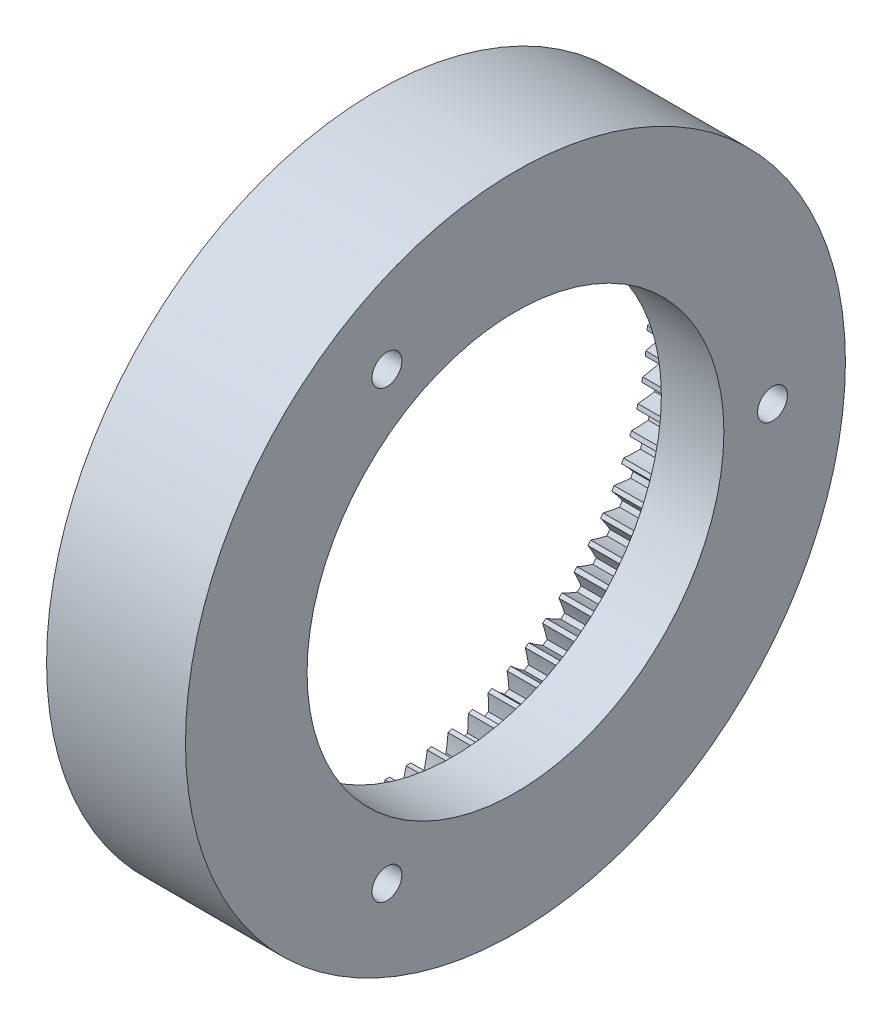
from build123d import *

# Parameters (mm, degrees)
BASPROSKE_W         = 10
BASPROSKE_H         = 8.5
TOOTHCUT_DEPTH      = 68.915388536
TEETHCUTS_COUNT     = 80
TEETHCUTS_ANGLE     = 355.5
SKETCH1_R           = 47.5
BOSS_EXTRUDE1_DEPTH = 1
BOSS_EXTRUDE3_START = 9
SKETCH3_R           = 47.5
BOSS_EXTRUDE3_DEPTH = 9
SKETCH4_R           = 2.15
CUT_EXTRUDE1_DEPTH  = 7
SKETCH4_3_R         = 30
CUT_EXTRUDE2_DEPTH  = 71.089228844


with BuildPart() as part:
    # BasProSke → Base-Revolve (revolve)
    with BuildSketch(Plane(origin=(0, 0, 0), x_dir=(1, 0, 0), z_dir=(0, 1, 0))):
        with Locations((5, 43.25)):
            Rectangle(BASPROSKE_W, BASPROSKE_H)
    revolve(axis=Axis((-10, 0, 0), (1, 0, 0)))

    # TooCutSke → ToothCut (cut, through all)
    with BuildSketch(Plane(origin=(0, 0, 0), x_dir=(0, 0, -1), z_dir=(1, 0, 0))):
        with BuildLine():
            ThreePointArc((1.225305221, 38.955334324), (0.834368139, 40.115367933), (0.373194628, 41.249311834))
            ThreePointArc((0.373194628, 41.249311834), (0, 41.251), (-0.373194628, 41.249311834))
            ThreePointArc((-0.373194628, 41.249311834), (-0.834368139, 40.115367933), (-1.225305221, 38.955334324))
            ThreePointArc((-1.225305221, 38.955334324), (0, 38.9746), (1.225305221, 38.955334324))
        make_face()
    toothcut = extrude(amount=TOOTHCUT_DEPTH, mode=Mode.SUBTRACT)

    # TeethCuts: ToothCut ×80 about axis
    teethcuts_axis = Axis((-10, 0, 0), (1, 0, 0))
    for i in range(1, TEETHCUTS_COUNT):
        add(toothcut.rotate(teethcuts_axis, i * TEETHCUTS_ANGLE / (TEETHCUTS_COUNT - 1)), mode=Mode.SUBTRACT)

    # Sketch1 → Boss-Extrude1 (add)
    with BuildSketch(Plane(origin=(10, 0, 0), x_dir=(0, 0, -1), z_dir=(1, 0, 0))):
        Circle(SKETCH1_R)
        with BuildLine():
            ThreePointArc((2.864339513, 41.151434485), (2.321264091, 40.069331457), (1.844660728, 38.956350276))
            ThreePointArc((1.844660728, 38.956350276), (1.531132815, 38.969932413), (1.217505761, 38.980991261))
            ThreePointArc((1.217505761, 38.980991261), (0.829695104, 40.127935362), (0.373194628, 41.249311834))
            ThreePointArc((0.373194628, 41.249311834), (0, 41.251), (-0.373194628, 41.249311834))
            ThreePointArc((-0.373194628, 41.249311834), (-0.829695104, 40.127935362), (-1.217505761, 38.980991261))
            ThreePointArc((-1.217505761, 38.980991261), (-1.531132815, 38.969932413), (-1.844660728, 38.956350276))
            ThreePointArc((-1.844660728, 38.956350276), (-2.321264091, 40.069331457), (-2.864339513, 41.151434485))
            ThreePointArc((-2.864339513, 41.151434485), (-3.236516158, 41.123836934), (-3.608427899, 41.092873459))
            ThreePointArc((-3.608427899, 41.092873459), (-3.975538953, 39.939137202), (-4.272165922, 38.765301474))
            ThreePointArc((-4.272165922, 38.765301474), (-4.583958501, 38.729669821), (-4.89545427, 38.691530436))
            ThreePointArc((-4.89545427, 38.691530436), (-5.457911921, 39.763686799), (-6.084214047, 40.799844858))
            ThreePointArc((-6.084214047, 40.799844858), (-6.453078117, 40.743131738), (-6.821414013, 40.683083854))
            ThreePointArc((-6.821414013, 40.683083854), (-7.096872282, 39.50410098), (-7.300486759, 38.310610711))
            ThreePointArc((-7.300486759, 38.310610711), (-7.608522559, 38.250625936), (-7.916065709, 38.188164445))
            ThreePointArc((-7.916065709, 38.188164445), (-8.560909909, 39.212885789), (-9.266577379, 40.19671062))
            ThreePointArc((-9.266577379, 40.19671062), (-9.629854704, 40.111231586), (-9.99234384, 40.022469509))
            ThreePointArc((-9.99234384, 40.022469509), (-10.174451033, 38.825508838), (-10.283797668, 37.619722295))
            ThreePointArc((-10.283797668, 37.619722295), (-10.586177545, 37.535754222), (-10.88787197, 37.449355722))
            ThreePointArc((-10.88787197, 37.449355722), (-11.611127041, 38.420324299), (-12.39180918, 39.345750294))
            ThreePointArc((-12.39180918, 39.345750294), (-12.747260035, 39.232032354), (-13.101667545, 39.11510333))
            ThreePointArc((-13.101667545, 39.11510333), (-13.189300911, 37.907544524), (-13.203705545, 36.69689578))
            ThreePointArc((-13.203705545, 36.69689578), (-13.498565226, 36.589462101), (-13.79255088, 36.479659267))
            ThreePointArc((-13.79255088, 36.479659267), (-14.589757713, 37.390888733), (-15.440641357, 38.252210335))
            ThreePointArc((-15.440641357, 38.252210335), (-15.786074268, 38.110954596), (-16.130215113, 37.966579532))
            ThreePointArc((-16.130215113, 37.966579532), (-16.122834363, 36.755867593), (-16.042208186, 35.5478207))
            ThreePointArc((-16.042208186, 35.5478207), (-16.327729764, 35.417583779), (-16.612194127, 35.285053582))
            ThreePointArc((-16.612194127, 35.285053582), (-17.478437678, 36.130925905), (-18.394276845, 36.922832778))
            ThreePointArc((-18.394276845, 36.922832778), (-18.727562105, 36.754910129), (-19.059314541, 36.583979147))
            ThreePointArc((-19.059314541, 36.583979147), (-18.956965179, 35.377578515), (-18.781805279, 34.179581484))
            ThreePointArc((-18.781805279, 34.179581484), (-19.056228418, 34.027344276), (-19.329417673, 33.872903808))
            ThreePointArc((-19.329417673, 33.872903808), (-20.259357262, 34.648203903), (-21.2345055, 35.365813679))
            ThreePointArc((-21.2345055, 35.365813679), (-21.553588293, 35.17225942), (-21.870906957, 34.975826364))
            ThreePointArc((-21.870906957, 34.975826364), (-21.674220001, 33.781174901), (-21.405606297, 32.600613783))
            ThreePointArc((-21.405606297, 32.600613783), (-21.667239088, 32.42731488), (-21.927468932, 32.251916319))
            ThreePointArc((-21.927468932, 32.251916319), (-22.915371172, 32.951864203), (-23.943816367, 33.590752578))
            ThreePointArc((-23.943816367, 33.590752578), (-24.246729442, 33.372760035), (-24.547657959, 33.152035981))
            ThreePointArc((-24.547657959, 33.152035981), (-24.25784605, 31.976499111), (-23.897434635, 30.820652457))
            ThreePointArc((-23.897434635, 30.820652457), (-24.144664023, 30.627360304), (-24.390330053, 30.43208504))
            ThreePointArc((-24.390330053, 30.43208504), (-25.430104198, 31.052365302), (-26.505505644, 31.608593318))
            ThreePointArc((-26.505505644, 31.608593318), (-26.790381442, 31.367506487), (-27.073064487, 31.123852273))
            ThreePointArc((-27.073064487, 31.123852273), (-26.691914411, 29.974677571), (-26.241927341, 28.85067156))
            ThreePointArc((-26.241927341, 28.85067156), (-26.473229076, 28.638577868), (-26.702816679, 28.424629838))
            ThreePointArc((-26.702816679, 28.424629838), (-27.788052175, 28.961418244), (-28.903779665, 29.431556569))
            ThreePointArc((-28.903779665, 29.431556569), (-29.168861831, 29.168861831), (-29.431556569, 28.903779665))
            ThreePointArc((-29.431556569, 28.903779665), (-28.961418244, 27.788052175), (-28.424629838, 26.702816679))
            ThreePointArc((-28.424629838, 26.702816679), (-28.638577868, 26.473229076), (-28.85067156, 26.241927341))
            ThreePointArc((-28.85067156, 26.241927341), (-29.974677571, 26.691914411), (-31.123852273, 27.073064487))
            ThreePointArc((-31.123852273, 27.073064487), (-31.367506487, 26.790381442), (-31.608593318, 26.505505644))
            ThreePointArc((-31.608593318, 26.505505644), (-31.052365302, 25.430104198), (-30.43208504, 24.390330053))
            ThreePointArc((-30.43208504, 24.390330053), (-30.627360304, 24.144664023), (-30.820652457, 23.897434635))
            ThreePointArc((-30.820652457, 23.897434635), (-31.976499111, 24.25784605), (-33.152035981, 24.547657959))
            ThreePointArc((-33.152035981, 24.547657959), (-33.372760035, 24.246729442), (-33.590752578, 23.943816367))
            ThreePointArc((-33.590752578, 23.943816367), (-32.951864203, 22.915371172), (-32.251916319, 21.927468932))
            ThreePointArc((-32.251916319, 21.927468932), (-32.42731488, 21.667239088), (-32.600613783, 21.405606297))
            ThreePointArc((-32.600613783, 21.405606297), (-33.781174901, 21.674220001), (-34.975826364, 21.870906957))
            ThreePointArc((-34.975826364, 21.870906957), (-35.17225942, 21.553588293), (-35.365813679, 21.2345055))
            ThreePointArc((-35.365813679, 21.2345055), (-34.648203903, 20.259357262), (-33.872903808, 19.329417673))
            ThreePointArc((-33.872903808, 19.329417673), (-34.027344276, 19.056228418), (-34.179581484, 18.781805279))
            ThreePointArc((-34.179581484, 18.781805279), (-35.377578515, 18.956965179), (-36.583979147, 19.059314541))
            ThreePointArc((-36.583979147, 19.059314541), (-36.754910129, 18.727562105), (-36.922832778, 18.394276845))
            ThreePointArc((-36.922832778, 18.394276845), (-36.130925905, 17.478437678), (-35.285053582, 16.612194127))
            ThreePointArc((-35.285053582, 16.612194127), (-35.417583779, 16.327729764), (-35.5478207, 16.042208186))
            ThreePointArc((-35.5478207, 16.042208186), (-36.755867593, 16.122834363), (-37.966579532, 16.130215113))
            ThreePointArc((-37.966579532, 16.130215113), (-38.110954596, 15.786074268), (-38.252210335, 15.440641357))
            ThreePointArc((-38.252210335, 15.440641357), (-37.390888733, 14.589757713), (-36.479659267, 13.79255088))
            ThreePointArc((-36.479659267, 13.79255088), (-36.589462101, 13.498565226), (-36.69689578, 13.203705545))
            ThreePointArc((-36.69689578, 13.203705545), (-37.907544524, 13.189300911), (-39.11510333, 13.101667545))
            ThreePointArc((-39.11510333, 13.101667545), (-39.232032354, 12.747260035), (-39.345750294, 12.39180918))
            ThreePointArc((-39.345750294, 12.39180918), (-38.420324299, 11.611127041), (-37.449355722, 10.88787197))
            ThreePointArc((-37.449355722, 10.88787197), (-37.535754222, 10.586177545), (-37.619722295, 10.283797668))
            ThreePointArc((-37.619722295, 10.283797668), (-38.825508838, 10.174451033), (-40.022469509, 9.99234384))
            ThreePointArc((-40.022469509, 9.99234384), (-40.111231586, 9.629854704), (-40.19671062, 9.266577379))
            ThreePointArc((-40.19671062, 9.266577379), (-39.212885789, 8.560909909), (-38.188164445, 7.916065709))
            ThreePointArc((-38.188164445, 7.916065709), (-38.250625936, 7.608522559), (-38.310610711, 7.300486759))
            ThreePointArc((-38.310610711, 7.300486759), (-39.50410098, 7.096872282), (-40.683083854, 6.821414013))
            ThreePointArc((-40.683083854, 6.821414013), (-40.743131738, 6.453078117), (-40.799844858, 6.084214047))
            ThreePointArc((-40.799844858, 6.084214047), (-39.763686799, 5.457911921), (-38.691530436, 4.89545427))
            ThreePointArc((-38.691530436, 4.89545427), (-38.729669821, 4.583958501), (-38.765301474, 4.272165922))
            ThreePointArc((-38.765301474, 4.272165922), (-39.939137202, 3.975538953), (-41.092873459, 3.608427899))
            ThreePointArc((-41.092873459, 3.608427899), (-41.123836934, 3.236516158), (-41.151434485, 2.864339513))
            ThreePointArc((-41.151434485, 2.864339513), (-40.069331457, 2.321264091), (-38.956350276, 1.844660728))
            ThreePointArc((-38.956350276, 1.844660728), (-38.969932413, 1.531132815), (-38.980991261, 1.217505761))
            ThreePointArc((-38.980991261, 1.217505761), (-40.127935362, 0.829695104), (-41.249311834, 0.373194628))
            ThreePointArc((-41.249311834, 0.373194628), (-41.251, 0), (-41.249311834, -0.373194628))
            ThreePointArc((-41.249311834, -0.373194628), (-40.127935362, -0.829695104), (-38.980991261, -1.217505761))
            ThreePointArc((-38.980991261, -1.217505761), (-38.969932413, -1.531132815), (-38.956350276, -1.844660728))
            ThreePointArc((-38.956350276, -1.844660728), (-40.069331457, -2.321264091), (-41.151434485, -2.864339513))
            ThreePointArc((-41.151434485, -2.864339513), (-41.123836934, -3.236516158), (-41.092873459, -3.608427899))
            ThreePointArc((-41.092873459, -3.608427899), (-39.939137202, -3.975538953), (-38.765301474, -4.272165922))
            ThreePointArc((-38.765301474, -4.272165922), (-38.729669821, -4.583958501), (-38.691530436, -4.89545427))
            ThreePointArc((-38.691530436, -4.89545427), (-39.763686799, -5.457911921), (-40.799844858, -6.084214047))
            ThreePointArc((-40.799844858, -6.084214047), (-40.743131738, -6.453078117), (-40.683083854, -6.821414013))
            ThreePointArc((-40.683083854, -6.821414013), (-39.50410098, -7.096872282), (-38.310610711, -7.300486759))
            ThreePointArc((-38.310610711, -7.300486759), (-38.250625936, -7.608522559), (-38.188164445, -7.916065709))
            ThreePointArc((-38.188164445, -7.916065709), (-39.212885789, -8.560909909), (-40.19671062, -9.266577379))
            ThreePointArc((-40.19671062, -9.266577379), (-40.111231586, -9.629854704), (-40.022469509, -9.99234384))
            ThreePointArc((-40.022469509, -9.99234384), (-38.825508838, -10.174451033), (-37.619722295, -10.283797668))
            ThreePointArc((-37.619722295, -10.283797668), (-37.535754222, -10.586177545), (-37.449355722, -10.88787197))
            ThreePointArc((-37.449355722, -10.88787197), (-38.420324299, -11.611127041), (-39.345750294, -12.39180918))
            ThreePointArc((-39.345750294, -12.39180918), (-39.232032354, -12.747260035), (-39.11510333, -13.101667545))
            ThreePointArc((-39.11510333, -13.101667545), (-37.907544524, -13.189300911), (-36.69689578, -13.203705545))
            ThreePointArc((-36.69689578, -13.203705545), (-36.589462101, -13.498565226), (-36.479659267, -13.79255088))
            ThreePointArc((-36.479659267, -13.79255088), (-37.390888733, -14.589757713), (-38.252210335, -15.440641357))
            ThreePointArc((-38.252210335, -15.440641357), (-38.110954596, -15.786074268), (-37.966579532, -16.130215113))
            ThreePointArc((-37.966579532, -16.130215113), (-36.755867593, -16.122834363), (-35.5478207, -16.042208186))
            ThreePointArc((-35.5478207, -16.042208186), (-35.417583779, -16.327729764), (-35.285053582, -16.612194127))
            ThreePointArc((-35.285053582, -16.612194127), (-36.130925905, -17.478437678), (-36.922832778, -18.394276845))
            ThreePointArc((-36.922832778, -18.394276845), (-36.754910129, -18.727562105), (-36.583979147, -19.059314541))
            ThreePointArc((-36.583979147, -19.059314541), (-35.377578515, -18.956965179), (-34.179581484, -18.781805279))
            ThreePointArc((-34.179581484, -18.781805279), (-34.027344276, -19.056228418), (-33.872903808, -19.329417673))
            ThreePointArc((-33.872903808, -19.329417673), (-34.648203903, -20.259357262), (-35.365813679, -21.2345055))
            ThreePointArc((-35.365813679, -21.2345055), (-35.17225942, -21.553588293), (-34.975826364, -21.870906957))
            ThreePointArc((-34.975826364, -21.870906957), (-33.781174901, -21.674220001), (-32.600613783, -21.405606297))
            ThreePointArc((-32.600613783, -21.405606297), (-32.42731488, -21.667239088), (-32.251916319, -21.927468932))
            ThreePointArc((-32.251916319, -21.927468932), (-32.951864203, -22.915371172), (-33.590752578, -23.943816367))
            ThreePointArc((-33.590752578, -23.943816367), (-33.372760035, -24.246729442), (-33.152035981, -24.547657959))
            ThreePointArc((-33.152035981, -24.547657959), (-31.976499111, -24.25784605), (-30.820652457, -23.897434635))
            ThreePointArc((-30.820652457, -23.897434635), (-30.627360304, -24.144664023), (-30.43208504, -24.390330053))
            ThreePointArc((-30.43208504, -24.390330053), (-31.052365302, -25.430104198), (-31.608593318, -26.505505644))
            ThreePointArc((-31.608593318, -26.505505644), (-31.367506487, -26.790381442), (-31.123852273, -27.073064487))
            ThreePointArc((-31.123852273, -27.073064487), (-29.974677571, -26.691914411), (-28.85067156, -26.241927341))
            ThreePointArc((-28.85067156, -26.241927341), (-28.638577868, -26.473229076), (-28.424629838, -26.702816679))
            ThreePointArc((-28.424629838, -26.702816679), (-28.961418244, -27.788052175), (-29.431556569, -28.903779665))
            ThreePointArc((-29.431556569, -28.903779665), (-29.168861831, -29.168861831), (-28.903779665, -29.431556569))
            ThreePointArc((-28.903779665, -29.431556569), (-27.788052175, -28.961418244), (-26.702816679, -28.424629838))
            ThreePointArc((-26.702816679, -28.424629838), (-26.473229076, -28.638577868), (-26.241927341, -28.85067156))
            ThreePointArc((-26.241927341, -28.85067156), (-26.691914411, -29.974677571), (-27.073064487, -31.123852273))
            ThreePointArc((-27.073064487, -31.123852273), (-26.790381442, -31.367506487), (-26.505505644, -31.608593318))
            ThreePointArc((-26.505505644, -31.608593318), (-25.430104198, -31.052365302), (-24.390330053, -30.43208504))
            ThreePointArc((-24.390330053, -30.43208504), (-24.144664023, -30.627360304), (-23.897434635, -30.820652457))
            ThreePointArc((-23.897434635, -30.820652457), (-24.25784605, -31.976499111), (-24.547657959, -33.152035981))
            ThreePointArc((-24.547657959, -33.152035981), (-24.246729442, -33.372760035), (-23.943816367, -33.590752578))
            ThreePointArc((-23.943816367, -33.590752578), (-22.915371172, -32.951864203), (-21.927468932, -32.251916319))
            ThreePointArc((-21.927468932, -32.251916319), (-21.667239088, -32.42731488), (-21.405606297, -32.600613783))
            ThreePointArc((-21.405606297, -32.600613783), (-21.674220001, -33.781174901), (-21.870906957, -34.975826364))
            ThreePointArc((-21.870906957, -34.975826364), (-21.553588293, -35.17225942), (-21.2345055, -35.365813679))
            ThreePointArc((-21.2345055, -35.365813679), (-20.259357262, -34.648203903), (-19.329417673, -33.872903808))
            ThreePointArc((-19.329417673, -33.872903808), (-19.056228418, -34.027344276), (-18.781805279, -34.179581484))
            ThreePointArc((-18.781805279, -34.179581484), (-18.956965179, -35.377578515), (-19.059314541, -36.583979147))
            ThreePointArc((-19.059314541, -36.583979147), (-18.727562105, -36.754910129), (-18.394276845, -36.922832778))
            ThreePointArc((-18.394276845, -36.922832778), (-17.478437678, -36.130925905), (-16.612194127, -35.285053582))
            ThreePointArc((-16.612194127, -35.285053582), (-16.327729764, -35.417583779), (-16.042208186, -35.5478207))
            ThreePointArc((-16.042208186, -35.5478207), (-16.122834363, -36.755867593), (-16.130215113, -37.966579532))
            ThreePointArc((-16.130215113, -37.966579532), (-15.786074268, -38.110954596), (-15.440641357, -38.252210335))
            ThreePointArc((-15.440641357, -38.252210335), (-14.589757713, -37.390888733), (-13.79255088, -36.479659267))
            ThreePointArc((-13.79255088, -36.479659267), (-13.498565226, -36.589462101), (-13.203705545, -36.69689578))
            ThreePointArc((-13.203705545, -36.69689578), (-13.189300911, -37.907544524), (-13.101667545, -39.11510333))
            ThreePointArc((-13.101667545, -39.11510333), (-12.747260035, -39.232032354), (-12.39180918, -39.345750294))
            ThreePointArc((-12.39180918, -39.345750294), (-11.611127041, -38.420324299), (-10.88787197, -37.449355722))
            ThreePointArc((-10.88787197, -37.449355722), (-10.586177545, -37.535754222), (-10.283797668, -37.619722295))
            ThreePointArc((-10.283797668, -37.619722295), (-10.174451033, -38.825508838), (-9.99234384, -40.022469509))
            ThreePointArc((-9.99234384, -40.022469509), (-9.629854704, -40.111231586), (-9.266577379, -40.19671062))
            ThreePointArc((-9.266577379, -40.19671062), (-8.560909909, -39.212885789), (-7.916065709, -38.188164445))
            ThreePointArc((-7.916065709, -38.188164445), (-7.608522559, -38.250625936), (-7.300486759, -38.310610711))
            ThreePointArc((-7.300486759, -38.310610711), (-7.096872282, -39.50410098), (-6.821414013, -40.683083854))
            ThreePointArc((-6.821414013, -40.683083854), (-6.453078117, -40.743131738), (-6.084214047, -40.799844858))
            ThreePointArc((-6.084214047, -40.799844858), (-5.457911921, -39.763686799), (-4.89545427, -38.691530436))
            ThreePointArc((-4.89545427, -38.691530436), (-4.583958501, -38.729669821), (-4.272165922, -38.765301474))
            ThreePointArc((-4.272165922, -38.765301474), (-3.975538953, -39.939137202), (-3.608427899, -41.092873459))
            ThreePointArc((-3.608427899, -41.092873459), (-3.236516158, -41.123836934), (-2.864339513, -41.151434485))
            ThreePointArc((-2.864339513, -41.151434485), (-2.321264091, -40.069331457), (-1.844660728, -38.956350276))
            ThreePointArc((-1.844660728, -38.956350276), (-1.531132815, -38.969932413), (-1.217505761, -38.980991261))
            ThreePointArc((-1.217505761, -38.980991261), (-0.829695104, -40.127935362), (-0.373194628, -41.249311834))
            ThreePointArc((-0.373194628, -41.249311834), (0, -41.251), (0.373194628, -41.249311834))
            ThreePointArc((0.373194628, -41.249311834), (0.829695104, -40.127935362), (1.217505761, -38.980991261))
            ThreePointArc((1.217505761, -38.980991261), (1.531132815, -38.969932413), (1.844660728, -38.956350276))
            ThreePointArc((1.844660728, -38.956350276), (2.321264091, -40.069331457), (2.864339513, -41.151434485))
            ThreePointArc((2.864339513, -41.151434485), (3.236516158, -41.123836934), (3.608427899, -41.092873459))
            ThreePointArc((3.608427899, -41.092873459), (3.975538953, -39.939137202), (4.272165922, -38.765301474))
            ThreePointArc((4.272165922, -38.765301474), (4.583958501, -38.729669821), (4.89545427, -38.691530436))
            ThreePointArc((4.89545427, -38.691530436), (5.457911921, -39.763686799), (6.084214047, -40.799844858))
            ThreePointArc((6.084214047, -40.799844858), (6.453078117, -40.743131738), (6.821414013, -40.683083854))
            ThreePointArc((6.821414013, -40.683083854), (7.096872282, -39.50410098), (7.300486759, -38.310610711))
            ThreePointArc((7.300486759, -38.310610711), (7.608522559, -38.250625936), (7.916065709, -38.188164445))
            ThreePointArc((7.916065709, -38.188164445), (8.560909909, -39.212885789), (9.266577379, -40.19671062))
            ThreePointArc((9.266577379, -40.19671062), (9.629854704, -40.111231586), (9.99234384, -40.022469509))
            ThreePointArc((9.99234384, -40.022469509), (10.174451033, -38.825508838), (10.283797668, -37.619722295))
            ThreePointArc((10.283797668, -37.619722295), (10.586177545, -37.535754222), (10.88787197, -37.449355722))
            ThreePointArc((10.88787197, -37.449355722), (11.611127041, -38.420324299), (12.39180918, -39.345750294))
            ThreePointArc((12.39180918, -39.345750294), (12.747260035, -39.232032354), (13.101667545, -39.11510333))
            ThreePointArc((13.101667545, -39.11510333), (13.189300911, -37.907544524), (13.203705545, -36.69689578))
            ThreePointArc((13.203705545, -36.69689578), (13.498565226, -36.589462101), (13.79255088, -36.479659267))
            ThreePointArc((13.79255088, -36.479659267), (14.589757713, -37.390888733), (15.440641357, -38.252210335))
            ThreePointArc((15.440641357, -38.252210335), (15.786074268, -38.110954596), (16.130215113, -37.966579532))
            ThreePointArc((16.130215113, -37.966579532), (16.122834363, -36.755867593), (16.042208186, -35.5478207))
            ThreePointArc((16.042208186, -35.5478207), (16.327729764, -35.417583779), (16.612194127, -35.285053582))
            ThreePointArc((16.612194127, -35.285053582), (17.478437678, -36.130925905), (18.394276845, -36.922832778))
            ThreePointArc((18.394276845, -36.922832778), (18.727562105, -36.754910129), (19.059314541, -36.583979147))
            ThreePointArc((19.059314541, -36.583979147), (18.956965179, -35.377578515), (18.781805279, -34.179581484))
            ThreePointArc((18.781805279, -34.179581484), (19.056228418, -34.027344276), (19.329417673, -33.872903808))
            ThreePointArc((19.329417673, -33.872903808), (20.259357262, -34.648203903), (21.2345055, -35.365813679))
            ThreePointArc((21.2345055, -35.365813679), (21.553588293, -35.17225942), (21.870906957, -34.975826364))
            ThreePointArc((21.870906957, -34.975826364), (21.674220001, -33.781174901), (21.405606297, -32.600613783))
            ThreePointArc((21.405606297, -32.600613783), (21.667239088, -32.42731488), (21.927468932, -32.251916319))
            ThreePointArc((21.927468932, -32.251916319), (22.915371172, -32.951864203), (23.943816367, -33.590752578))
            ThreePointArc((23.943816367, -33.590752578), (24.246729442, -33.372760035), (24.547657959, -33.152035981))
            ThreePointArc((24.547657959, -33.152035981), (24.25784605, -31.976499111), (23.897434635, -30.820652457))
            ThreePointArc((23.897434635, -30.820652457), (24.144664023, -30.627360304), (24.390330053, -30.43208504))
            ThreePointArc((24.390330053, -30.43208504), (25.430104198, -31.052365302), (26.505505644, -31.608593318))
            ThreePointArc((26.505505644, -31.608593318), (26.790381442, -31.367506487), (27.073064487, -31.123852273))
            ThreePointArc((27.073064487, -31.123852273), (26.691914411, -29.974677571), (26.241927341, -28.85067156))
            ThreePointArc((26.241927341, -28.85067156), (26.473229076, -28.638577868), (26.702816679, -28.424629838))
            ThreePointArc((26.702816679, -28.424629838), (27.788052175, -28.961418244), (28.903779665, -29.431556569))
            ThreePointArc((28.903779665, -29.431556569), (29.168861831, -29.168861831), (29.431556569, -28.903779665))
            ThreePointArc((29.431556569, -28.903779665), (28.961418244, -27.788052175), (28.424629838, -26.702816679))
            ThreePointArc((28.424629838, -26.702816679), (28.638577868, -26.473229076), (28.85067156, -26.241927341))
            ThreePointArc((28.85067156, -26.241927341), (29.974677571, -26.691914411), (31.123852273, -27.073064487))
            ThreePointArc((31.123852273, -27.073064487), (31.367506487, -26.790381442), (31.608593318, -26.505505644))
            ThreePointArc((31.608593318, -26.505505644), (31.052365302, -25.430104198), (30.43208504, -24.390330053))
            ThreePointArc((30.43208504, -24.390330053), (30.627360304, -24.144664023), (30.820652457, -23.897434635))
            ThreePointArc((30.820652457, -23.897434635), (31.976499111, -24.25784605), (33.152035981, -24.547657959))
            ThreePointArc((33.152035981, -24.547657959), (33.372760035, -24.246729442), (33.590752578, -23.943816367))
            ThreePointArc((33.590752578, -23.943816367), (32.951864203, -22.915371172), (32.251916319, -21.927468932))
            ThreePointArc((32.251916319, -21.927468932), (32.42731488, -21.667239088), (32.600613783, -21.405606297))
            ThreePointArc((32.600613783, -21.405606297), (33.781174901, -21.674220001), (34.975826364, -21.870906957))
            ThreePointArc((34.975826364, -21.870906957), (35.17225942, -21.553588293), (35.365813679, -21.2345055))
            ThreePointArc((35.365813679, -21.2345055), (34.648203903, -20.259357262), (33.872903808, -19.329417673))
            ThreePointArc((33.872903808, -19.329417673), (34.027344276, -19.056228418), (34.179581484, -18.781805279))
            ThreePointArc((34.179581484, -18.781805279), (35.377578515, -18.956965179), (36.583979147, -19.059314541))
            ThreePointArc((36.583979147, -19.059314541), (36.754910129, -18.727562105), (36.922832778, -18.394276845))
            ThreePointArc((36.922832778, -18.394276845), (36.130925905, -17.478437678), (35.285053582, -16.612194127))
            ThreePointArc((35.285053582, -16.612194127), (35.417583779, -16.327729764), (35.5478207, -16.042208186))
            ThreePointArc((35.5478207, -16.042208186), (36.755867593, -16.122834363), (37.966579532, -16.130215113))
            ThreePointArc((37.966579532, -16.130215113), (38.110954596, -15.786074268), (38.252210335, -15.440641357))
            ThreePointArc((38.252210335, -15.440641357), (37.390888733, -14.589757713), (36.479659267, -13.79255088))
            ThreePointArc((36.479659267, -13.79255088), (36.589462101, -13.498565226), (36.69689578, -13.203705545))
            ThreePointArc((36.69689578, -13.203705545), (37.907544524, -13.189300911), (39.11510333, -13.101667545))
            ThreePointArc((39.11510333, -13.101667545), (39.232032354, -12.747260035), (39.345750294, -12.39180918))
            ThreePointArc((39.345750294, -12.39180918), (38.420324299, -11.611127041), (37.449355722, -10.88787197))
            ThreePointArc((37.449355722, -10.88787197), (37.535754222, -10.586177545), (37.619722295, -10.283797668))
            ThreePointArc((37.619722295, -10.283797668), (38.825508838, -10.174451033), (40.022469509, -9.99234384))
            ThreePointArc((40.022469509, -9.99234384), (40.111231586, -9.629854704), (40.19671062, -9.266577379))
            ThreePointArc((40.19671062, -9.266577379), (39.212885789, -8.560909909), (38.188164445, -7.916065709))
            ThreePointArc((38.188164445, -7.916065709), (38.250625936, -7.608522559), (38.310610711, -7.300486759))
            ThreePointArc((38.310610711, -7.300486759), (39.50410098, -7.096872282), (40.683083854, -6.821414013))
            ThreePointArc((40.683083854, -6.821414013), (40.743131738, -6.453078117), (40.799844858, -6.084214047))
            ThreePointArc((40.799844858, -6.084214047), (39.763686799, -5.457911921), (38.691530436, -4.89545427))
            ThreePointArc((38.691530436, -4.89545427), (38.729669821, -4.583958501), (38.765301474, -4.272165922))
            ThreePointArc((38.765301474, -4.272165922), (39.939137202, -3.975538953), (41.092873459, -3.608427899))
            ThreePointArc((41.092873459, -3.608427899), (41.123836934, -3.236516158), (41.151434485, -2.864339513))
            ThreePointArc((41.151434485, -2.864339513), (40.069331457, -2.321264091), (38.956350276, -1.844660728))
            ThreePointArc((38.956350276, -1.844660728), (38.969932413, -1.531132815), (38.980991261, -1.217505761))
            ThreePointArc((38.980991261, -1.217505761), (40.127935362, -0.829695104), (41.249311834, -0.373194628))
            ThreePointArc((41.249311834, -0.373194628), (41.251, 0), (41.249311834, 0.373194628))
            ThreePointArc((41.249311834, 0.373194628), (40.127935362, 0.829695104), (38.980991261, 1.217505761))
            ThreePointArc((38.980991261, 1.217505761), (38.969932413, 1.531132815), (38.956350276, 1.844660728))
            ThreePointArc((38.956350276, 1.844660728), (40.069331457, 2.321264091), (41.151434485, 2.864339513))
            ThreePointArc((41.151434485, 2.864339513), (41.123836934, 3.236516158), (41.092873459, 3.608427899))
            ThreePointArc((41.092873459, 3.608427899), (39.939137202, 3.975538953), (38.765301474, 4.272165922))
            ThreePointArc((38.765301474, 4.272165922), (38.729669821, 4.583958501), (38.691530436, 4.89545427))
            ThreePointArc((38.691530436, 4.89545427), (39.763686799, 5.457911921), (40.799844858, 6.084214047))
            ThreePointArc((40.799844858, 6.084214047), (40.743131738, 6.453078117), (40.683083854, 6.821414013))
            ThreePointArc((40.683083854, 6.821414013), (39.50410098, 7.096872282), (38.310610711, 7.300486759))
            ThreePointArc((38.310610711, 7.300486759), (38.250625936, 7.608522559), (38.188164445, 7.916065709))
            ThreePointArc((38.188164445, 7.916065709), (39.212885789, 8.560909909), (40.19671062, 9.266577379))
            ThreePointArc((40.19671062, 9.266577379), (40.111231586, 9.629854704), (40.022469509, 9.99234384))
            ThreePointArc((40.022469509, 9.99234384), (38.825508838, 10.174451033), (37.619722295, 10.283797668))
            ThreePointArc((37.619722295, 10.283797668), (37.535754222, 10.586177545), (37.449355722, 10.88787197))
            ThreePointArc((37.449355722, 10.88787197), (38.420324299, 11.611127041), (39.345750294, 12.39180918))
            ThreePointArc((39.345750294, 12.39180918), (39.232032354, 12.747260035), (39.11510333, 13.101667545))
            ThreePointArc((39.11510333, 13.101667545), (37.907544524, 13.189300911), (36.69689578, 13.203705545))
            ThreePointArc((36.69689578, 13.203705545), (36.589462101, 13.498565226), (36.479659267, 13.79255088))
            ThreePointArc((36.479659267, 13.79255088), (37.390888733, 14.589757713), (38.252210335, 15.440641357))
            ThreePointArc((38.252210335, 15.440641357), (38.110954596, 15.786074268), (37.966579532, 16.130215113))
            ThreePointArc((37.966579532, 16.130215113), (36.755867593, 16.122834363), (35.5478207, 16.042208186))
            ThreePointArc((35.5478207, 16.042208186), (35.417583779, 16.327729764), (35.285053582, 16.612194127))
            ThreePointArc((35.285053582, 16.612194127), (36.130925905, 17.478437678), (36.922832778, 18.394276845))
            ThreePointArc((36.922832778, 18.394276845), (36.754910129, 18.727562105), (36.583979147, 19.059314541))
            ThreePointArc((36.583979147, 19.059314541), (35.377578515, 18.956965179), (34.179581484, 18.781805279))
            ThreePointArc((34.179581484, 18.781805279), (34.027344276, 19.056228418), (33.872903808, 19.329417673))
            ThreePointArc((33.872903808, 19.329417673), (34.648203903, 20.259357262), (35.365813679, 21.2345055))
            ThreePointArc((35.365813679, 21.2345055), (35.17225942, 21.553588293), (34.975826364, 21.870906957))
            ThreePointArc((34.975826364, 21.870906957), (33.781174901, 21.674220001), (32.600613783, 21.405606297))
            ThreePointArc((32.600613783, 21.405606297), (32.42731488, 21.667239088), (32.251916319, 21.927468932))
            ThreePointArc((32.251916319, 21.927468932), (32.951864203, 22.915371172), (33.590752578, 23.943816367))
            ThreePointArc((33.590752578, 23.943816367), (33.372760035, 24.246729442), (33.152035981, 24.547657959))
            ThreePointArc((33.152035981, 24.547657959), (31.976499111, 24.25784605), (30.820652457, 23.897434635))
            ThreePointArc((30.820652457, 23.897434635), (30.627360304, 24.144664023), (30.43208504, 24.390330053))
            ThreePointArc((30.43208504, 24.390330053), (31.052365302, 25.430104198), (31.608593318, 26.505505644))
            ThreePointArc((31.608593318, 26.505505644), (31.367506487, 26.790381442), (31.123852273, 27.073064487))
            ThreePointArc((31.123852273, 27.073064487), (29.974677571, 26.691914411), (28.85067156, 26.241927341))
            ThreePointArc((28.85067156, 26.241927341), (28.638577868, 26.473229076), (28.424629838, 26.702816679))
            ThreePointArc((28.424629838, 26.702816679), (28.961418244, 27.788052175), (29.431556569, 28.903779665))
            ThreePointArc((29.431556569, 28.903779665), (29.168861831, 29.168861831), (28.903779665, 29.431556569))
            ThreePointArc((28.903779665, 29.431556569), (27.788052175, 28.961418244), (26.702816679, 28.424629838))
            ThreePointArc((26.702816679, 28.424629838), (26.473229076, 28.638577868), (26.241927341, 28.85067156))
            ThreePointArc((26.241927341, 28.85067156), (26.691914411, 29.974677571), (27.073064487, 31.123852273))
            ThreePointArc((27.073064487, 31.123852273), (26.790381442, 31.367506487), (26.505505644, 31.608593318))
            ThreePointArc((26.505505644, 31.608593318), (25.430104198, 31.052365302), (24.390330053, 30.43208504))
            ThreePointArc((24.390330053, 30.43208504), (24.144664023, 30.627360304), (23.897434635, 30.820652457))
            ThreePointArc((23.897434635, 30.820652457), (24.25784605, 31.976499111), (24.547657959, 33.152035981))
            ThreePointArc((24.547657959, 33.152035981), (24.246729442, 33.372760035), (23.943816367, 33.590752578))
            ThreePointArc((23.943816367, 33.590752578), (22.915371172, 32.951864203), (21.927468932, 32.251916319))
            ThreePointArc((21.927468932, 32.251916319), (21.667239088, 32.42731488), (21.405606297, 32.600613783))
            ThreePointArc((21.405606297, 32.600613783), (21.674220001, 33.781174901), (21.870906957, 34.975826364))
            ThreePointArc((21.870906957, 34.975826364), (21.553588293, 35.17225942), (21.2345055, 35.365813679))
            ThreePointArc((21.2345055, 35.365813679), (20.259357262, 34.648203903), (19.329417673, 33.872903808))
            ThreePointArc((19.329417673, 33.872903808), (19.056228418, 34.027344276), (18.781805279, 34.179581484))
            ThreePointArc((18.781805279, 34.179581484), (18.956965179, 35.377578515), (19.059314541, 36.583979147))
            ThreePointArc((19.059314541, 36.583979147), (18.727562105, 36.754910129), (18.394276845, 36.922832778))
            ThreePointArc((18.394276845, 36.922832778), (17.478437678, 36.130925905), (16.612194127, 35.285053582))
            ThreePointArc((16.612194127, 35.285053582), (16.327729764, 35.417583779), (16.042208186, 35.5478207))
            ThreePointArc((16.042208186, 35.5478207), (16.122834363, 36.755867593), (16.130215113, 37.966579532))
            ThreePointArc((16.130215113, 37.966579532), (15.786074268, 38.110954596), (15.440641357, 38.252210335))
            ThreePointArc((15.440641357, 38.252210335), (14.589757713, 37.390888733), (13.79255088, 36.479659267))
            ThreePointArc((13.79255088, 36.479659267), (13.498565226, 36.589462101), (13.203705545, 36.69689578))
            ThreePointArc((13.203705545, 36.69689578), (13.189300911, 37.907544524), (13.101667545, 39.11510333))
            ThreePointArc((13.101667545, 39.11510333), (12.747260035, 39.232032354), (12.39180918, 39.345750294))
            ThreePointArc((12.39180918, 39.345750294), (11.611127041, 38.420324299), (10.88787197, 37.449355722))
            ThreePointArc((10.88787197, 37.449355722), (10.586177545, 37.535754222), (10.283797668, 37.619722295))
            ThreePointArc((10.283797668, 37.619722295), (10.174451033, 38.825508838), (9.99234384, 40.022469509))
            ThreePointArc((9.99234384, 40.022469509), (9.629854704, 40.111231586), (9.266577379, 40.19671062))
            ThreePointArc((9.266577379, 40.19671062), (8.560909909, 39.212885789), (7.916065709, 38.188164445))
            ThreePointArc((7.916065709, 38.188164445), (7.608522559, 38.250625936), (7.300486759, 38.310610711))
            ThreePointArc((7.300486759, 38.310610711), (7.096872282, 39.50410098), (6.821414013, 40.683083854))
            ThreePointArc((6.821414013, 40.683083854), (6.453078117, 40.743131738), (6.084214047, 40.799844858))
            ThreePointArc((6.084214047, 40.799844858), (5.457911921, 39.763686799), (4.89545427, 38.691530436))
            ThreePointArc((4.89545427, 38.691530436), (4.583958501, 38.729669821), (4.272165922, 38.765301474))
            ThreePointArc((4.272165922, 38.765301474), (3.975538953, 39.939137202), (3.608427899, 41.092873459))
            ThreePointArc((3.608427899, 41.092873459), (3.236516158, 41.123836934), (2.864339513, 41.151434485))
        make_face(mode=Mode.SUBTRACT)
    extrude(amount=BOSS_EXTRUDE1_DEPTH)

    # Sketch3 → Boss-Extrude3 (add)
    with BuildSketch(Plane(origin=(11, 0, 0), x_dir=(0, 0, -1), z_dir=(1, 0, 0)).offset(BOSS_EXTRUDE3_START)):
        Circle(SKETCH3_R)
    extrude(amount=-BOSS_EXTRUDE3_DEPTH)

    # Sketch4 → Cut-Extrude1 (cut)
    with BuildSketch(Plane(origin=(20, 0, 0), x_dir=(0, 0, -1), z_dir=(1, 0, 0))):
        with Locations((37, 0)):
            Circle(SKETCH4_R)
        with Locations((-18.5, -32.04293994)):
            Circle(SKETCH4_R)
        with Locations((-18.5, 32.04293994)):
            Circle(SKETCH4_R)
    extrude(amount=-CUT_EXTRUDE1_DEPTH, mode=Mode.SUBTRACT)

    # Sketch4<3> → Cut-Extrude2 (cut, through all)
    with BuildSketch(Plane(origin=(20, 0, 0), x_dir=(0, 0, -1), z_dir=(1, 0, 0))):
        Circle(SKETCH4_3_R)
    extrude(amount=-CUT_EXTRUDE2_DEPTH, mode=Mode.SUBTRACT)


solid = part.part
